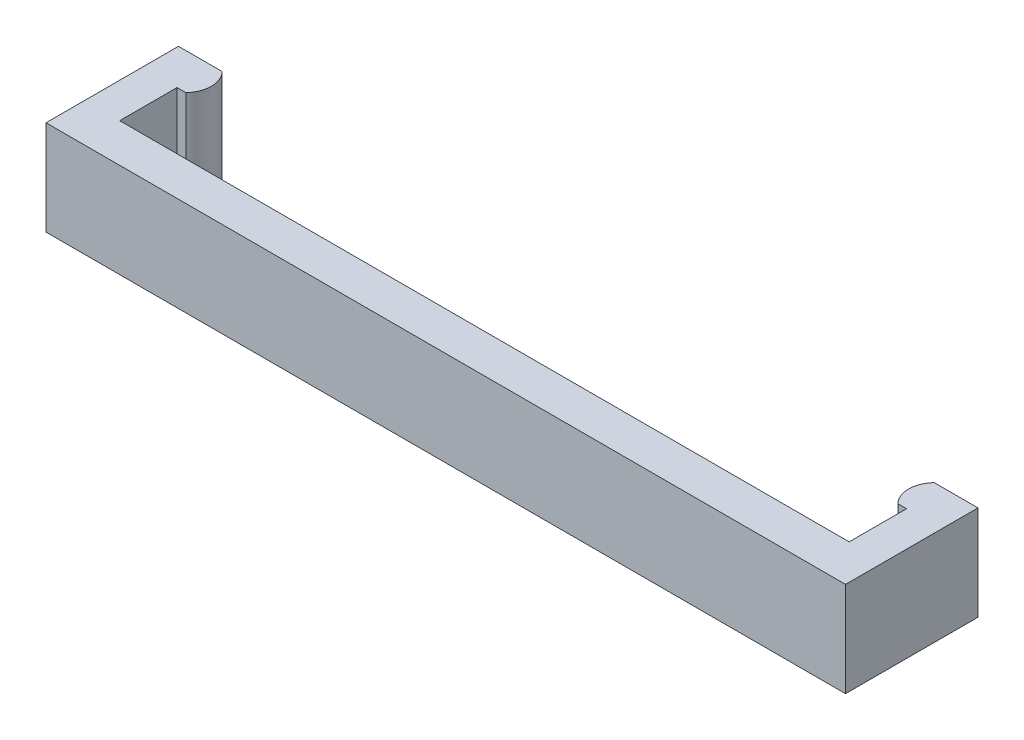
from build123d import *

# Parameters (mm, degrees)
SKETCH2_W           = 54.8
SKETCH2_H           = 9.08
BOSS_EXTRUDE1_DEPTH = 6.49
SKETCH3_W           = 50
SKETCH3_H           = 6.43
CUT_EXTRUDE1_DEPTH  = 57.521498565
BOSS_EXTRUDE2_DEPTH = 6.49


with BuildPart() as part:
    # Sketch2 → Boss-Extrude1 (new body)
    with BuildSketch(Plane.XZ):
        with Locations((13.46, 33.97)):
            Rectangle(SKETCH2_W, SKETCH2_H)
    extrude(amount=BOSS_EXTRUDE1_DEPTH)

    # Sketch3 → Cut-Extrude1 (cut, through all)
    with BuildSketch(Plane(origin=(0, 0, 0), x_dir=(1, 0, 0), z_dir=(0, 1, 0))):
        with Locations((13.46, -32.645)):
            Rectangle(SKETCH3_W, SKETCH3_H)
    extrude(amount=-CUT_EXTRUDE1_DEPTH, mode=Mode.SUBTRACT)

    # Sketch4 → Boss-Extrude2 (add, through all)
    with BuildSketch(Plane(origin=(0, 0, 0), x_dir=(1, 0, 0), z_dir=(0, 1, 0))):
        with BuildLine():
            Line((38.46, -29.43), (37.86, -29.43))
            ThreePointArc((37.86, -29.43), (37.36, -30.68), (37.86, -31.93))
            Line((37.86, -31.93), (38.46, -31.93))
            Line((38.46, -31.93), (38.46, -29.43))
        make_face()
        with BuildLine():
            Line((-10.94, -31.93), (-11.54, -31.93))
            Line((-11.54, -31.93), (-11.54, -29.43))
            Line((-11.54, -29.43), (-10.94, -29.43))
            ThreePointArc((-10.94, -29.43), (-10.44, -30.68), (-10.94, -31.93))
        make_face()
    extrude(amount=-BOSS_EXTRUDE2_DEPTH)


solid = part.part
